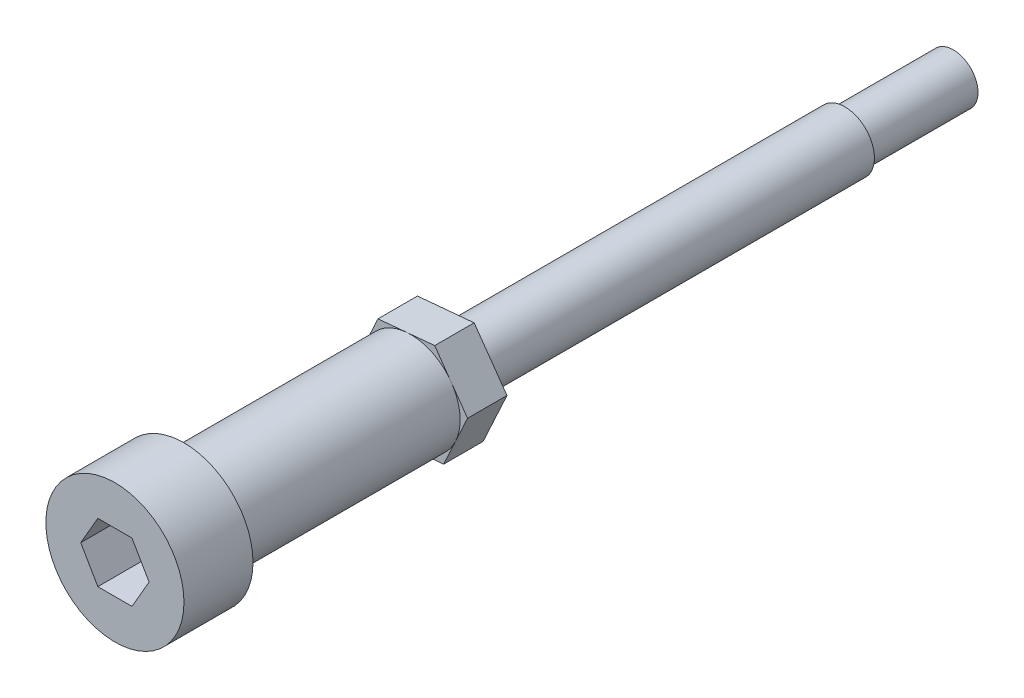
from build123d import *

# Parameters (mm, degrees)
ENL_V_MAT_EXTRU_1_DEPTH = 10
BOSS_EXTRU_1_DEPTH      = 8


with BuildPart() as part:
    # Esquisse2 → Base-Révolution (revolve)
    with BuildSketch(Plane(origin=(0, 0, 0), x_dir=(0, 0, -1), z_dir=(1, 0, 0)), mode=Mode.PRIVATE) as base_r_volution_sk:
        Polygon((0, 0), (0, 14), (14, 14), (14, 10), (60, 10), (60, 6), (148, 6), (148, 5), (170, 5), (170, 0), align=None)
    revolve(base_r_volution_sk.sketch.rotate(Axis((0, 0, 67), (0, 0, -1)), 90), axis=Axis((0, 0, 67), (0, 0, -1)))

    # Esquisse3 → Enlèv. mat.-Extru.1 (cut)
    with BuildSketch(Plane.XY):
        Polygon((6.92820323, 0), (3.464101615, 6), (-3.464101615, 6), (-6.92820323, 0), (-3.464101615, -6), (3.464101615, -6), align=None)
    extrude(amount=-ENL_V_MAT_EXTRU_1_DEPTH, mode=Mode.SUBTRACT)

    # Esquisse7 → Boss.-Extru.1 (add)
    with BuildSketch(Plane(origin=(0, 0, -60), x_dir=(-1, 0, 0), z_dir=(0, 0, -1))):
        Polygon((4.838867031, -10.484211901), (11.499027361, -1.051524176), (6.660160329, 9.432687725), (-4.838867031, 10.484211901), (-11.499027361, 1.051524176), (-6.660160329, -9.432687725), align=None)
    extrude(amount=BOSS_EXTRU_1_DEPTH)


solid = part.part
